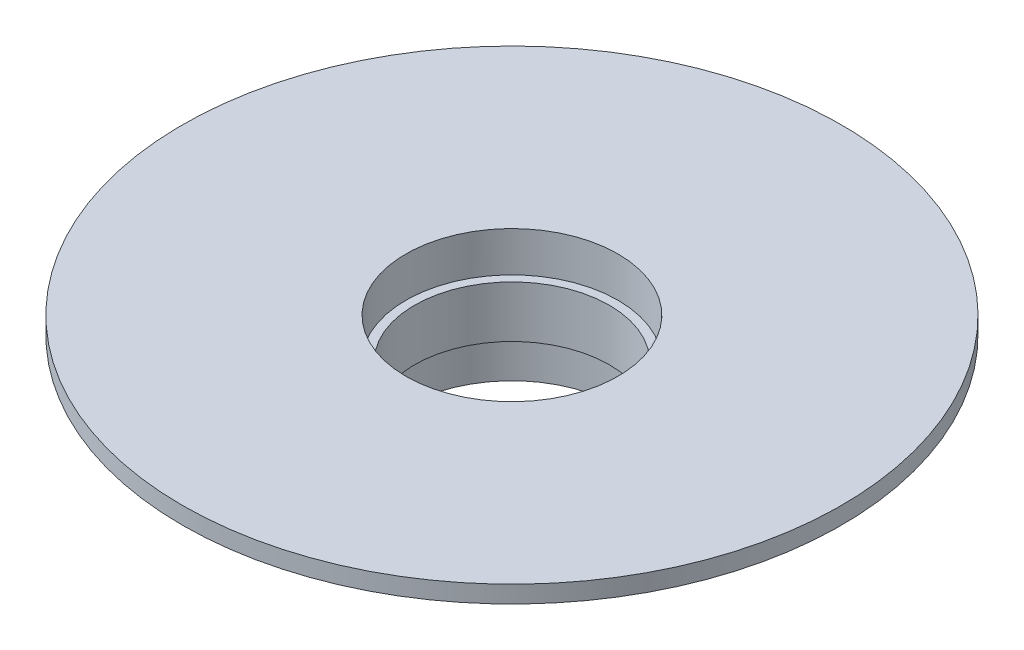
from build123d import *

# Parameters (mm, degrees)
SKETCH1_R           = 57.5
SKETCH1_R_2         = 18.5
BOSS_EXTRUDE1_DEPTH = 3
BOSS_EXTRUDE2_START = 2
SKETCH2_R           = 45
SKETCH2_R_2         = 18.5
BOSS_EXTRUDE2_DEPTH = 2
BOSS_EXTRUDE3_START = 18
SKETCH3_R           = 21
SKETCH3_R_2         = 18.5
BOSS_EXTRUDE3_DEPTH = 18
BOSS_EXTRUDE4_START = -7
SKETCH4_R           = 18.5
SKETCH4_R_2         = 17
BOSS_EXTRUDE4_DEPTH = 9


with BuildPart() as part:
    # Sketch1 → Boss-Extrude1 (new body)
    with BuildSketch(Plane(origin=(0, 0, 0), x_dir=(1, 0, 0), z_dir=(0, 1, 0))):
        Circle(SKETCH1_R)
        Circle(SKETCH1_R_2, mode=Mode.SUBTRACT)
    extrude(amount=BOSS_EXTRUDE1_DEPTH)

    # Sketch2 → Boss-Extrude2 (add)
    with BuildSketch(Plane.XZ.offset(BOSS_EXTRUDE2_START)):
        Circle(SKETCH2_R)
        Circle(SKETCH2_R_2, mode=Mode.SUBTRACT)
    extrude(amount=-BOSS_EXTRUDE2_DEPTH)

    # Sketch3 → Boss-Extrude3 (add)
    with BuildSketch(Plane.XZ.offset(2).offset(BOSS_EXTRUDE3_START)):
        Circle(SKETCH3_R)
        Circle(SKETCH3_R_2, mode=Mode.SUBTRACT)
    extrude(amount=-BOSS_EXTRUDE3_DEPTH)

    # Sketch4 → Boss-Extrude4 (add)
    with BuildSketch(Plane.XZ.offset(20).offset(BOSS_EXTRUDE4_START)):
        Circle(SKETCH4_R)
        Circle(SKETCH4_R_2, mode=Mode.SUBTRACT)
    extrude(amount=-BOSS_EXTRUDE4_DEPTH)


solid = part.part
